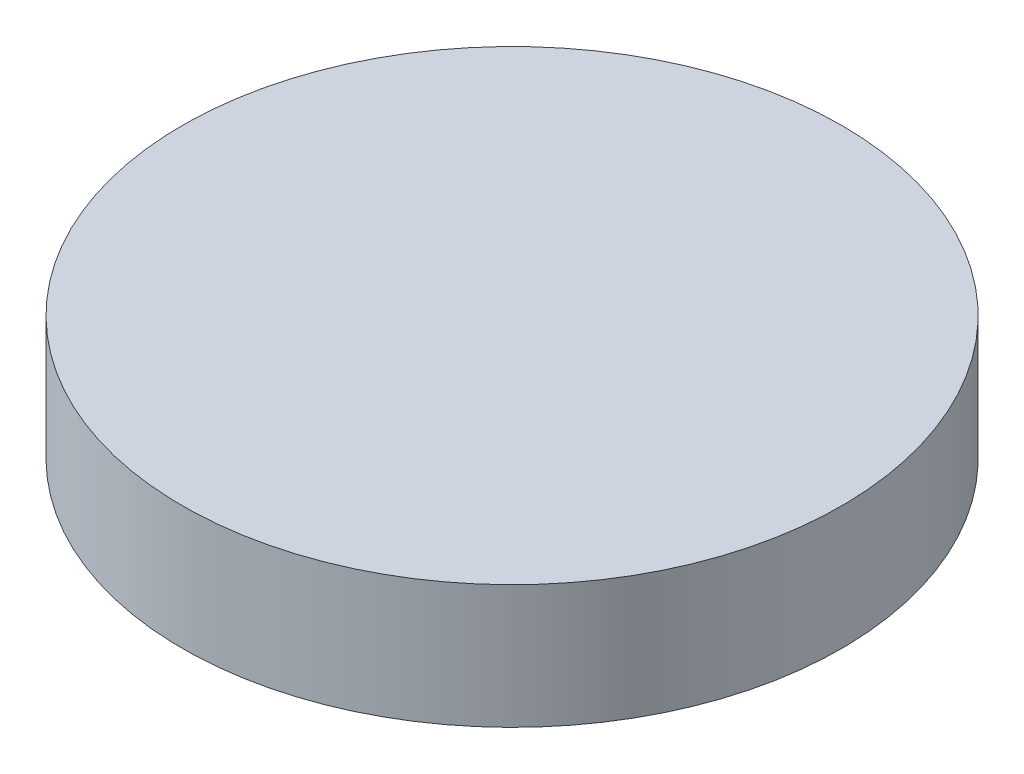
from build123d import *

# Parameters (mm, degrees)
SKETCH1_R           = 50.8
BOSS_EXTRUDE1_DEPTH = 19.05


with BuildPart() as part:
    # Sketch1 → Boss-Extrude1 (new body)
    with BuildSketch(Plane(origin=(0, 0, 0), x_dir=(1, 0, 0), z_dir=(0, 1, 0))):
        with Locations(Location((0, 0, 0), (0, 0, 90))):
            Circle(SKETCH1_R)
    extrude(amount=BOSS_EXTRUDE1_DEPTH)


solid = part.part
